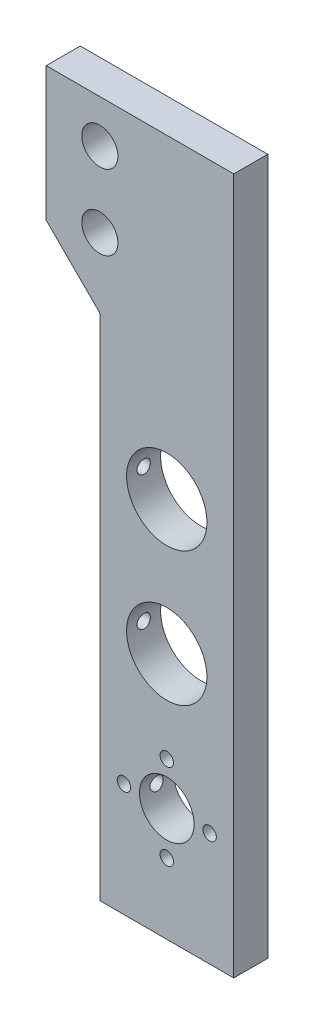
from build123d import *

# Parameters (mm, degrees)
SKETCH2_W                       = 25
SKETCH2_H                       = 130
SKETCH2_R                       = 5.1
SKETCH2_R_2                     = 7.5
BOSS_EXTRUDE1_DEPTH             = 6.35
TAP_DRILL_FOR_M3X0_5_TAP1_D     = 2.5
TAP_DRILL_FOR_M3X0_5_TAP1_DEPTH = 12.5
TAP_DRILL_FOR_M3X0_5_TAP1_TIP   = 0.751075774
BOSS_EXTRUDE2_DEPTH             = 6.35
F_1_4_CLEARANCE_HOLE1_D         = 6.7564
TAP_DRILL_FOR_M3X0_5_TAP2_D     = 2.5


with BuildPart() as part:
    # Sketch2 → Boss-Extrude1 (new body)
    with BuildSketch(Plane.XY):
        with Locations((0, 43.85)):
            Rectangle(SKETCH2_W, SKETCH2_H)
        Circle(SKETCH2_R, mode=Mode.SUBTRACT)
        with Locations((0, 25)):
            Circle(SKETCH2_R_2, mode=Mode.SUBTRACT)
        with Locations((0, 50)):
            Circle(SKETCH2_R_2, mode=Mode.SUBTRACT)
    extrude(amount=BOSS_EXTRUDE1_DEPTH)

    # Tap Drill for M3x0.5 Tap1
    with Locations(Plane.ZY.offset(12.5)):
        with Locations((3.175, 50), (3.175, 0), (3.175, 25)):
            Hole(TAP_DRILL_FOR_M3X0_5_TAP1_D / 2, depth=TAP_DRILL_FOR_M3X0_5_TAP1_DEPTH)
            with Locations((0, 0, -(TAP_DRILL_FOR_M3X0_5_TAP1_DEPTH + TAP_DRILL_FOR_M3X0_5_TAP1_TIP / 2))):  # 118° drill point
                Cone(0, TAP_DRILL_FOR_M3X0_5_TAP1_D / 2, TAP_DRILL_FOR_M3X0_5_TAP1_TIP, mode=Mode.SUBTRACT)

    # Sketch8 → Boss-Extrude2 (add)
    with BuildSketch(Plane(origin=(0, 0, 0), x_dir=(-1, 0, 0), z_dir=(0, 0, -1))):
        Polygon((12.5, 73.85), (22.5, 83.85), (22.5, 108.85), (12.5, 108.85), align=None)
    extrude(amount=-BOSS_EXTRUDE2_DEPTH)

    # 1/4 Clearance Hole1 (through all)
    with Locations(Plane.XY.offset(6.35)):
        with Locations((-12.5, 86.85), (-12.5, 100.85)):
            Hole(F_1_4_CLEARANCE_HOLE1_D / 2)

    # Tap Drill for M3x0.5 Tap2 (through all)
    with Locations(Plane.XY.offset(6.35)):
        with Locations((-8, 0), (0, 8), (8, 0), (0, -8)):
            Hole(TAP_DRILL_FOR_M3X0_5_TAP2_D / 2)


solid = part.part
